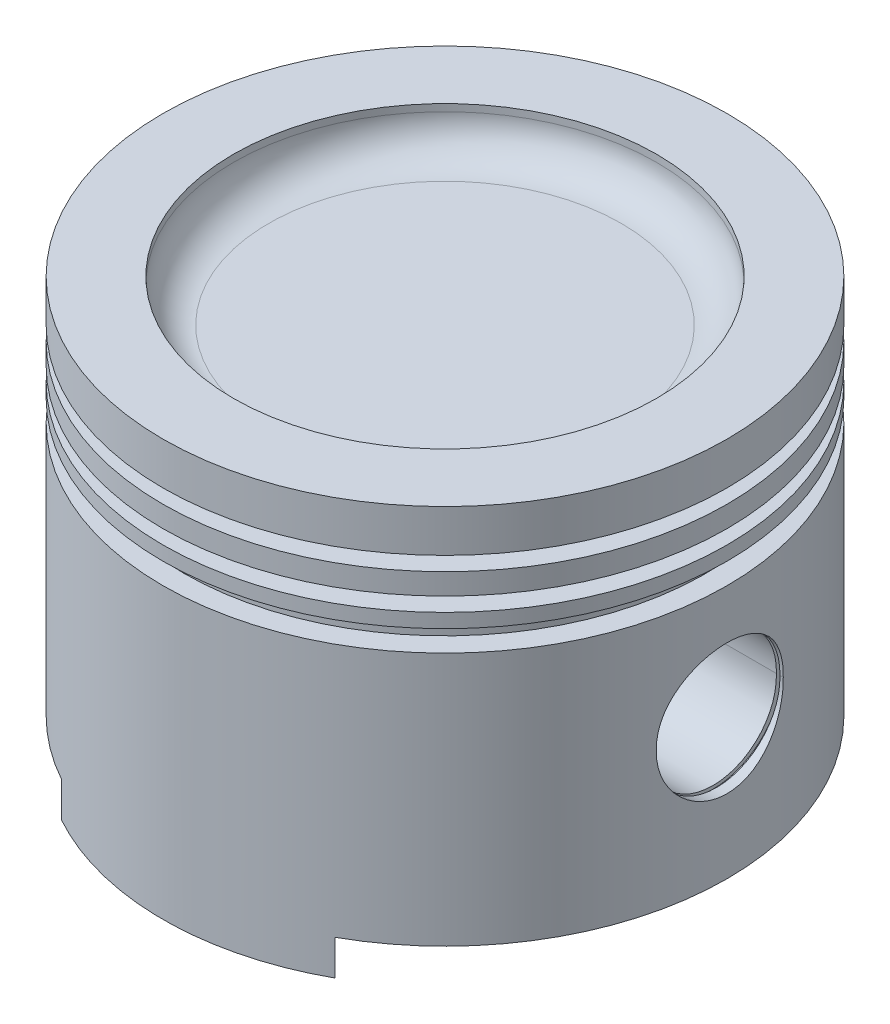
from build123d import *

# Parameters (mm, degrees)
SKETCH_1_R                                 = 40
EXTRUDE_1_DEPTH                            = 59
CUT_EXTRUDE_1_DEPTH                        = 5
SKETCH_4_R                                 = 9
CUT_EXTRUDE_2_DEPTH                        = 108.14942837
CUT_EXTRUDE_START                          = -2
SKETCH_7_R                                 = 40
SKETCH_7_R_2                               = 37
CUT_EXTRUDE_4_DEPTH                        = 2
SKETCH_8_R                                 = 40
SKETCH_8_R_2                               = 37
CUT_EXTRUDE_5_DEPTH                        = 2
CUT_EXTRUDE_START_2                        = -3
SKETCH_10_R                                = 40
SKETCH_10_R_2                              = 37
CUT_EXTRUDE_6_DEPTH                        = 3
SKETCH_6_R                                 = 30
CUT_EXTRUDE_7_DEPTH                        = 6
FILLET_2_R                                 = 5
SKETCH_17_R                                = 10
CUT_EXTRUDE_11_DEPTH                       = 0.5
MIRROR_1_AT_THE_SECOND_PLANE_COPY_1_SKET_R = 10
MIRROR_1_AT_THE_SECOND_PLANE_COPY_1_DEPTH  = 0.5
SKETCH_13_R                                = 27
CUT_EXTRUDE_12_DEPTH                       = 46.5
EXTRUDE_2_DEPTH                            = 19
SKETCH_21_R                                = 9
CUT_EXTRUDE_13_DEPTH                       = 108.149428482
SKETCH_22_R                                = 9
CUT_EXTRUDE_14_DEPTH                       = 89.82567207
FILLET_7_R                                 = 5


with BuildPart() as part:
    # 草图1 → 凸台-拉伸1 (new body)
    with BuildSketch(Plane(origin=(0, 0, 0), x_dir=(1, 0, 0), z_dir=(0, 1, 0))):
        Circle(SKETCH_1_R)
    extrude(amount=EXTRUDE_1_DEPTH)

    # 草图2 → 切除-拉伸1 (cut)
    with BuildSketch(Plane(origin=(0, 0, 0), x_dir=(-1, 0, 0), z_dir=(0, -1, 0))):
        with BuildLine():
            Line((-19.364916731, -35), (19.364916731, -35))
            ThreePointArc((19.364916731, -35), (40, 0), (19.364916731, 35))
            Line((19.364916731, 35), (-19.364916731, 35))
            ThreePointArc((-19.364916731, 35), (-40, 0), (-19.364916731, -35))
        make_face()
    extrude(amount=-CUT_EXTRUDE_1_DEPTH, mode=Mode.SUBTRACT)

    # 草图4 → 切除-拉伸2 (cut, through all)
    with BuildSketch(Plane(origin=(40, 0, 0), x_dir=(0, 0, -1), z_dir=(1, 0, 0))):
        with Locations((0, 25)):
            Circle(SKETCH_4_R)
    cut_extrude_2 = extrude(amount=-CUT_EXTRUDE_2_DEPTH, mode=Mode.SUBTRACT)

    # 草图7 → 切除-拉伸4 (cut)
    with BuildSketch(Plane(origin=(0, 53, 0), x_dir=(1, 0, 0), z_dir=(0, 1, 0)).offset(CUT_EXTRUDE_START)):
        Circle(SKETCH_7_R)
        Circle(SKETCH_7_R_2, mode=Mode.SUBTRACT)
    extrude(amount=CUT_EXTRUDE_4_DEPTH, mode=Mode.SUBTRACT)

    # 草图8 → 切除-拉伸5 (cut)
    with BuildSketch(Plane(origin=(0, 48, 0), x_dir=(1, 0, 0), z_dir=(0, 1, 0)).offset(CUT_EXTRUDE_START)):
        Circle(SKETCH_8_R)
        Circle(SKETCH_8_R_2, mode=Mode.SUBTRACT)
    extrude(amount=CUT_EXTRUDE_5_DEPTH, mode=Mode.SUBTRACT)

    # 草图10 → 切除-拉伸6 (cut)
    with BuildSketch(Plane(origin=(0, 44, 0), x_dir=(1, 0, 0), z_dir=(0, 1, 0)).offset(CUT_EXTRUDE_START_2)):
        Circle(SKETCH_10_R)
        Circle(SKETCH_10_R_2, mode=Mode.SUBTRACT)
    extrude(amount=CUT_EXTRUDE_6_DEPTH, mode=Mode.SUBTRACT)

    # 草图6 → 切除-拉伸7 (cut)
    with BuildSketch(Plane(origin=(0, 59, 0), x_dir=(1, 0, 0), z_dir=(0, 1, 0))):
        Circle(SKETCH_6_R)
    extrude(amount=-CUT_EXTRUDE_7_DEPTH, mode=Mode.SUBTRACT)

    # 圆角2
    fillet_2_edges = [part.edges().sort_by_distance(p)[0] for p in [
        (-30, 53, 0),
    ]]
    fillet(fillet_2_edges, radius=FILLET_2_R)

    # 草图17 → 切除-拉伸11 (cut)
    with BuildSketch(Plane(origin=(38, 0, 0), x_dir=(0, 0, -1), z_dir=(1, 0, 0))):
        with Locations((0, 25)):
            Circle(SKETCH_17_R)
    cut_extrude_11 = extrude(amount=CUT_EXTRUDE_11_DEPTH, mode=Mode.SUBTRACT)

    # 镜向1: 切除-拉伸11 across plane
    add(cut_extrude_11.mirror(Plane(origin=(0, 0, 0), x_dir=(0, 0, 1), z_dir=(1, 0, 0))), mode=Mode.SUBTRACT)

    # 镜向1 at the second plane: 切除-拉伸11 across plane
    add(cut_extrude_11.mirror(Plane.XY), mode=Mode.SUBTRACT)

    # 镜向1 at the second plane copy 1 sket → 镜向1 at the second plane copy 1 (cut)
    with BuildSketch(Plane.ZY.offset(38)):
        with Locations((0, 25)):
            Circle(MIRROR_1_AT_THE_SECOND_PLANE_COPY_1_SKET_R)
    extrude(amount=MIRROR_1_AT_THE_SECOND_PLANE_COPY_1_DEPTH, mode=Mode.SUBTRACT)

    # 草图13 → 切除-拉伸12 (cut)
    with BuildSketch(Plane(origin=(0, 0, 0), x_dir=(1, 0, 0), z_dir=(0, 1, 0))):
        Circle(SKETCH_13_R)
    extrude(amount=CUT_EXTRUDE_12_DEPTH, mode=Mode.SUBTRACT)

    # 草图16 → 凸台-拉伸2 (add)
    with BuildSketch(Plane(origin=(13, 0, 0), x_dir=(0, 0, -1), z_dir=(1, 0, 0))):
        with BuildLine():
            Line((-13, 25), (-13, 46.5))
            Line((-13, 46.5), (13, 46.5))
            Line((13, 46.5), (13, 25))
            ThreePointArc((13, 25), (0, 12), (-13, 25))
        make_face()
    extrude_2 = extrude(amount=EXTRUDE_2_DEPTH)

    # 草图21 → 切除-拉伸13 (cut, through all)
    with BuildSketch(Plane(origin=(40, 0, 0), x_dir=(0, 0, -1), z_dir=(1, 0, 0))):
        with Locations((0, 25)):
            Circle(SKETCH_21_R)
    extrude(amount=-CUT_EXTRUDE_13_DEPTH, mode=Mode.SUBTRACT)

    # 镜向2: 凸台-拉伸2 across plane
    add(extrude_2.mirror(Plane(origin=(0, 0, 0), x_dir=(0, 0, 1), z_dir=(1, 0, 0))))

    # 草图22 → 切除-拉伸14 (cut, through all)
    with BuildSketch(Plane(origin=(13, 0, 0), x_dir=(0, 0, -1), z_dir=(1, 0, 0))):
        with Locations((0, 24.451782415)):
            Circle(SKETCH_22_R)
    extrude(amount=CUT_EXTRUDE_14_DEPTH, mode=Mode.SUBTRACT)

    # 镜向3: 切除-拉伸2 across plane
    add(cut_extrude_2.mirror(Plane(origin=(0, 0, 0), x_dir=(0, 0, 1), z_dir=(1, 0, 0))), mode=Mode.SUBTRACT)

    # 圆角7
    fillet_7_edges = [part.edges().sort_by_distance(p)[0] for p in [
        (0, 46.5, -27),
        (0, 46.5, 27),
    ]]
    fillet(fillet_7_edges, radius=FILLET_7_R)


solid = part.part
